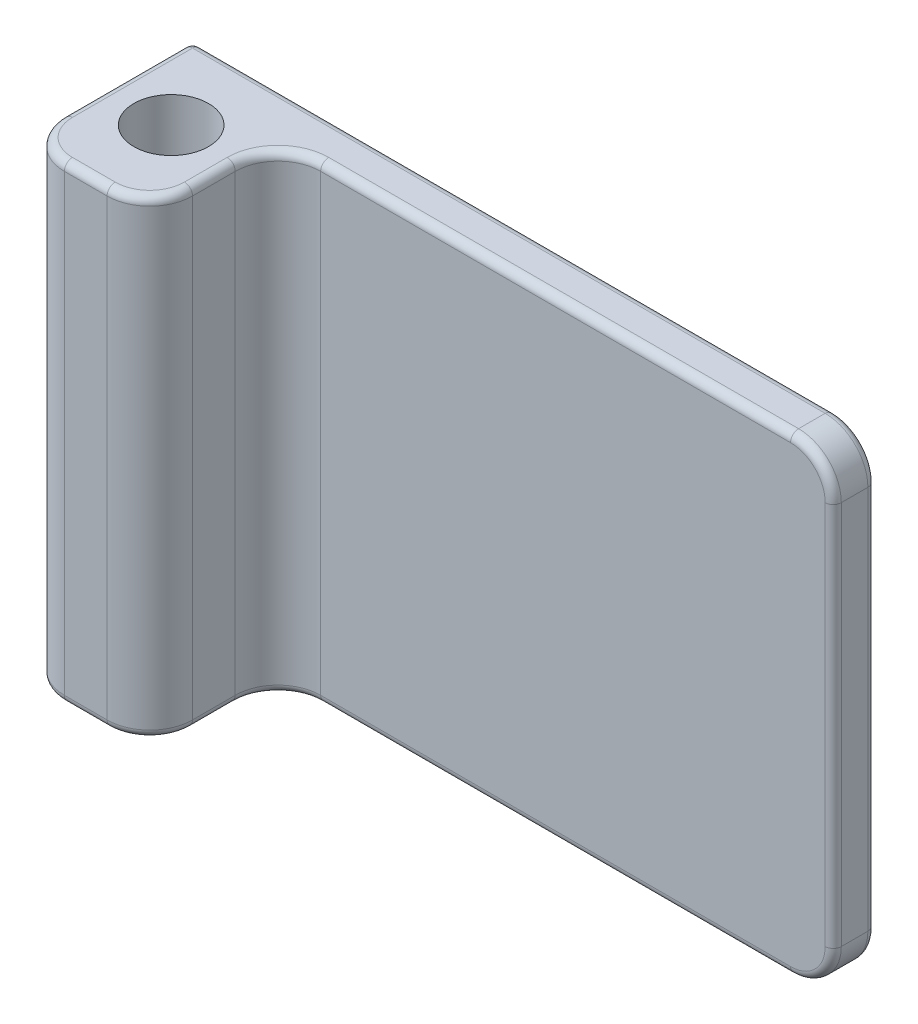
from build123d import *

# Parameters (mm, degrees)
CROQUIS1_W              = 203.2
CROQUIS1_H              = 139.7
SALIENTE_EXTRUIR1_DEPTH = 50.8
CROQUIS2_W              = 165.1
CROQUIS2_H              = 38.1
CORTAR_EXTRUIR1_DEPTH   = 181.05357536
CROQUIS3_R              = 11.1125
CORTAR_EXTRUIR2_DEPTH   = 181.05357536
REDONDEO1_R             = 12.7
REDONDEO2_R             = 12.7
REDONDEO3_R             = 2.4


with BuildPart() as part:
    # Croquis1 → Saliente-Extruir1 (new body)
    with BuildSketch(Plane.XY):
        Rectangle(CROQUIS1_W, CROQUIS1_H)
    extrude(amount=SALIENTE_EXTRUIR1_DEPTH)

    # Croquis2 → Cortar-Extruir1 (cut, through all)
    with BuildSketch(Plane.XZ.offset(69.85)):
        with Locations((19.05, 31.75)):
            Rectangle(CROQUIS2_W, CROQUIS2_H)
    extrude(amount=-CORTAR_EXTRUIR1_DEPTH, mode=Mode.SUBTRACT)

    # Croquis3 → Cortar-Extruir2 (cut, through all)
    with BuildSketch(Plane.XZ.offset(69.85)):
        with Locations(Location((-82.55, 25.4, 0), (0, 0, 270))):
            Circle(CROQUIS3_R)
    extrude(amount=-CORTAR_EXTRUIR2_DEPTH, mode=Mode.SUBTRACT)

    # Redondeo1
    redondeo1_edges = [part.edges().sort_by_distance(p)[0] for p in [
        (-101.6, 0, 50.8),
        (-63.5, 0, 12.7),
        (-63.5, 0, 50.8),
    ]]
    fillet(redondeo1_edges, radius=REDONDEO1_R)

    # Redondeo2
    redondeo2_edges = [part.edges().sort_by_distance(p)[0] for p in [
        (101.6, -69.85, 6.35),
        (101.6, 69.85, 6.35),
    ]]
    fillet(redondeo2_edges, radius=REDONDEO2_R)

    # Redondeo3
    redondeo3_edges = [part.edges().sort_by_distance(p)[0] for p in [
        (-82.55, 69.85, 50.8),
        (-82.55, -69.85, 50.8),
        (19.05, -69.85, 12.7),
        (-63.5, -69.85, 31.75),
        (-101.6, -69.85, 19.05),
        (-67.219743879, -69.85, 47.080256121),
        (-97.880256121, -69.85, 47.080256121),
        (-101.6, 69.85, 19.05),
        (-63.5, 69.85, 31.75),
        (19.05, 69.85, 12.7),
        (-67.219743879, 69.85, 47.080256121),
        (-97.880256121, 69.85, 47.080256121),
        (-59.780256121, -69.85, 16.419743879),
        (-59.780256121, 69.85, 16.419743879),
        (-6.35, -69.85, 0),
        (-6.35, 69.85, 0),
        (101.6, 0, 0),
        (-101.6, 0, 0),
        (97.880256121, -66.130256121, 0),
        (97.880256121, 66.130256121, 0),
        (101.6, 0, 12.7),
        (97.880256121, -66.130256121, 12.7),
        (97.880256121, 66.130256121, 12.7),
    ]]
    fillet(redondeo3_edges, radius=REDONDEO3_R)


solid = part.part
